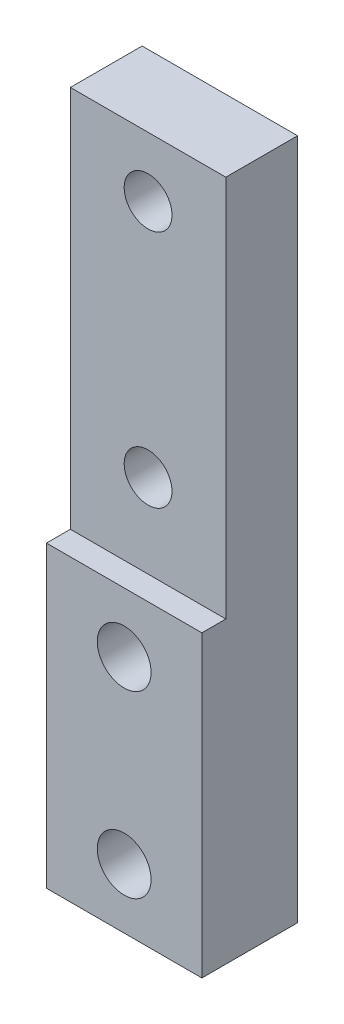
from build123d import *

# Parameters (mm, degrees)
SKETCH1_W                                     = 13
SKETCH1_H                                     = 25
SKETCH1_R                                     = 2
BOSS_EXTRUDE1_DEPTH                           = 8
SKETCH2_W                                     = 13
SKETCH2_H                                     = 32
SKETCH2_R                                     = 2
BOSS_EXTRUDE2_DEPTH                           = 6
CSK_FOR_M4_COUNTERSUNK_FLAT_HEAD1_D           = 4.5
CSK_FOR_M4_COUNTERSUNK_FLAT_HEAD1_CSINK_D     = 9.4
CSK_FOR_M4_COUNTERSUNK_FLAT_HEAD1_CSINK_ANGLE = 90


with BuildPart() as part:
    # Sketch1 → Boss-Extrude1 (new body)
    with BuildSketch(Plane.XY):
        Rectangle(SKETCH1_W, SKETCH1_H)
        with Locations((0, -7.5)):
            Circle(SKETCH1_R, mode=Mode.SUBTRACT)
        with Locations(Location((0, 7.5, 0), (0, 0, 180))):
            Circle(SKETCH1_R, mode=Mode.SUBTRACT)
    extrude(amount=BOSS_EXTRUDE1_DEPTH)

    # Sketch2 → Boss-Extrude2 (add)
    with BuildSketch(Plane(origin=(0, 0, 0), x_dir=(-1, 0, 0), z_dir=(0, 0, -1))):
        with Locations((0, 28.5)):
            Rectangle(SKETCH2_W, SKETCH2_H)
        with Locations((0, 39.5)):
            Circle(SKETCH2_R, mode=Mode.SUBTRACT)
        with Locations((0, 19.5)):
            Circle(SKETCH2_R, mode=Mode.SUBTRACT)
    extrude(amount=-BOSS_EXTRUDE2_DEPTH)

    # CSK for M4 Countersunk Flat Head1 (through all)
    with Locations(Plane(origin=(0, 0, 0), x_dir=(-1, 0, 0), z_dir=(0, 0, -1))):
        with Locations((0, -7.5), (0, 7.5)):
            CounterSinkHole(CSK_FOR_M4_COUNTERSUNK_FLAT_HEAD1_D / 2, CSK_FOR_M4_COUNTERSUNK_FLAT_HEAD1_CSINK_D / 2, counter_sink_angle=CSK_FOR_M4_COUNTERSUNK_FLAT_HEAD1_CSINK_ANGLE)


solid = part.part
